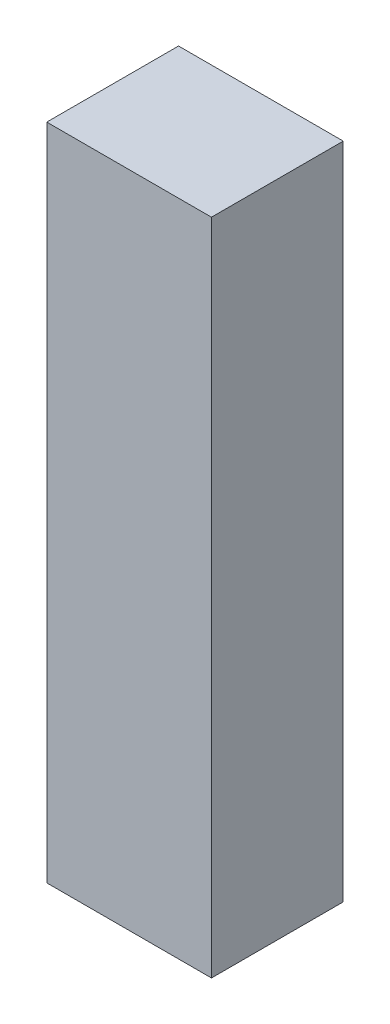
from build123d import *

# Parameters (mm, degrees)
TOPPING_ARKA_DUVAR_PANO_SURUCU_2_1_START = -736
SKETCH1_W                                = 50
SKETCH1_H                                = 200
TOPPING_ARKA_DUVAR_PANO_SURUCU_2_1_DEPTH = 40


with BuildPart() as part:
    # Sketch1 → TOPPING_arka_duvar_pano_surucu_2_1 (new body)
    with BuildSketch(Plane.XY.offset(TOPPING_ARKA_DUVAR_PANO_SURUCU_2_1_START)):
        with Locations((225, 430)):
            Rectangle(SKETCH1_W, SKETCH1_H)
    extrude(amount=-TOPPING_ARKA_DUVAR_PANO_SURUCU_2_1_DEPTH)


solid = part.part
